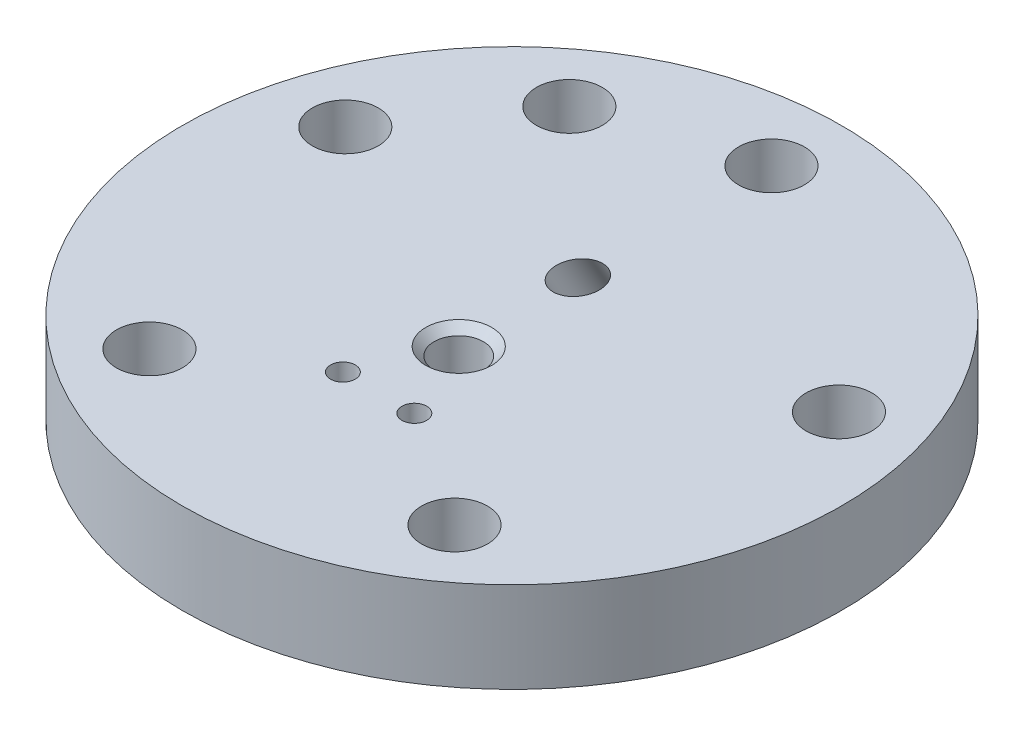
from build123d import *

# Parameters (mm, degrees)
SKETCH_1_R          = 40
SKETCH_1_R_2        = 4
EXTRUDE_1_DEPTH     = 11
SKETCH_3_R          = 3
CUT_EXTRUDE_1_DEPTH = 58.628118137
CHAMFER_1_SIZE      = 1
SKETCH_6_R          = 2.6
CUT_EXTRUDE_2_DEPTH = 10
SKETCH_7_R          = 1.5
CUT_EXTRUDE_3_DEPTH = 8


with BuildPart() as part:
    # 草图1 → 凸台-拉伸1 (new body)
    with BuildSketch(Plane(origin=(0, 0, 0), x_dir=(1, 0, 0), z_dir=(0, 1, 0))):
        Circle(SKETCH_1_R)
        with Locations((0, 31.5)):
            Circle(SKETCH_1_R_2, mode=Mode.SUBTRACT)
        with Locations((29.958280263, 9.734035323)):
            Circle(SKETCH_1_R_2, mode=Mode.SUBTRACT)
        with Locations((18.515235447, -25.484035323)):
            Circle(SKETCH_1_R_2, mode=Mode.SUBTRACT)
        with Locations((-18.515235447, -25.484035323)):
            Circle(SKETCH_1_R_2, mode=Mode.SUBTRACT)
        with Locations((-29.958280263, 9.734035323)):
            Circle(SKETCH_1_R_2, mode=Mode.SUBTRACT)
        with Locations((-18.515235447, 25.484035323)):
            Circle(SKETCH_1_R_2, mode=Mode.SUBTRACT)
    extrude(amount=EXTRUDE_1_DEPTH)

    # 草图3 → 切除-拉伸1 (cut, through all)
    with BuildSketch(Plane(origin=(0, 11, 0), x_dir=(1, 0, 0), z_dir=(0, 1, 0))):
        with Locations((0, -6.456029322)):
            Circle(SKETCH_3_R)
    extrude(amount=-CUT_EXTRUDE_1_DEPTH, mode=Mode.SUBTRACT)

    # 倒角1
    chamfer_1_edges = [part.edges().sort_by_distance(p)[0] for p in [
        (-3, 11, 6.456029322),
    ]]
    chamfer(chamfer_1_edges, length=CHAMFER_1_SIZE)

    # 草图6 → 切除-拉伸2 (cut, symmetric)
    with BuildSketch(Plane(origin=(0, 0, 0), x_dir=(1, 0, 0), z_dir=(0, 0.8660254037844398, 0.499999999999998))):
        with Locations((0, 12.42820323)):
            Circle(SKETCH_6_R)
    extrude(amount=CUT_EXTRUDE_2_DEPTH, both=True, mode=Mode.SUBTRACT)

    # 草图7 → 切除-拉伸3 (cut)
    with BuildSketch(Plane(origin=(0, 11, 0), x_dir=(1, 0, 0), z_dir=(0, 1, 0))):
        with Locations((-4.335219005, -16.17925759)):
            Circle(SKETCH_7_R)
        with Locations((4.335219005, -16.17925759)):
            Circle(SKETCH_7_R)
    extrude(amount=-CUT_EXTRUDE_3_DEPTH, mode=Mode.SUBTRACT)


solid = part.part
